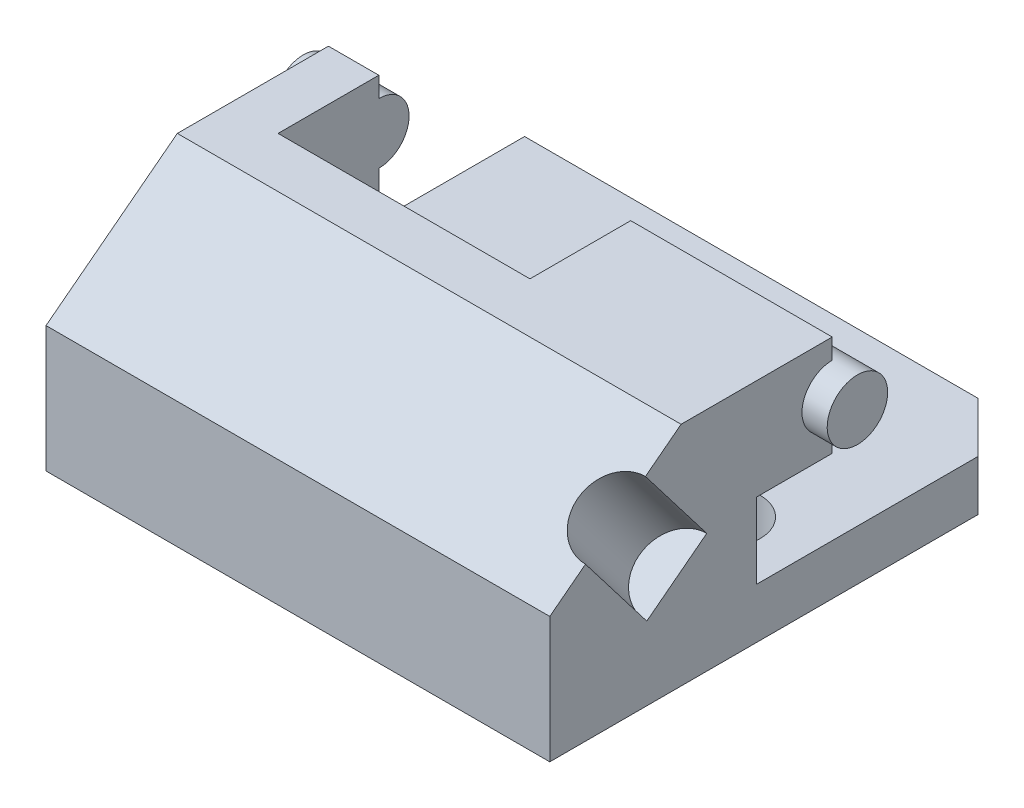
from build123d import *

# Parameters (mm, degrees)
ESQUISSE1_R             = 6
BOSS_EXTRU_1_DEPTH      = 100
ESQUISSE2_R             = 6
BOSS_EXTRU_2_DEPTH      = 5
BOSS_EXTRU_3_START      = 5
ESQUISSE3_R             = 6
BOSS_EXTRU_3_DEPTH      = 5
ENL_V_MAT_EXTRU_1_DEPTH = 20
ENL_V_MAT_EXTRU_3_REACH = 128.329
ESQUISSE5_W             = 50
ESQUISSE5_H             = 20
ESQUISSE6_W             = 50
ESQUISSE6_H             = 6
ENL_V_MAT_EXTRU_4_DEPTH = 40
ENL_V_MAT_EXTRU_5_DEPTH = 10
ENL_V_MAT_EXTRU_6_DEPTH = 10


with BuildPart() as part:
    # Esquisse1 → Boss.-Extru.1 (new body)
    with BuildSketch(Plane(origin=(0, 0, 0), x_dir=(0, 0, -1), z_dir=(1, 0, 0))):
        with BuildLine():
            Line((53.935492543, 0), (0, 0))
            Line((0, 0), (0, 15))
            Line((0, 15), (15, 15))
            Line((15, 15), (15, 19))
            ThreePointArc((15, 19), (9, 25), (15, 31))
            Line((15, 31), (15, 35))
            Line((15, 35), (-15, 35))
            Line((-15, 35), (-41.064507457, 15))
            Line((-41.064507457, 15), (-41.064507457, -10))
            Line((-41.064507457, -10), (53.935492543, -10))
            Line((53.935492543, -10), (53.935492543, 0))
        make_face()
        with Locations((15, 25)):
            Circle(ESQUISSE1_R)
    extrude(amount=BOSS_EXTRU_1_DEPTH)

    # Esquisse2 → Boss.-Extru.2 (add)
    with BuildSketch(Plane(origin=(100, 0, 0), x_dir=(0, 0, -1), z_dir=(1, 0, 0))):
        with Locations(Location((15, 25, 0), (0, 0, 90))):
            Circle(ESQUISSE2_R)
    extrude(amount=BOSS_EXTRU_2_DEPTH)

    # Esquisse3 → Boss.-Extru.3 (add)
    with BuildSketch(Plane.ZY.offset(BOSS_EXTRU_3_START)):
        with Locations((-15, 25)):
            Circle(ESQUISSE3_R)
    extrude(amount=-BOSS_EXTRU_3_DEPTH)

    # Esquisse4 → Enlèv. mat.-Extru.1 (cut)
    with BuildSketch(Plane(origin=(0, 29.273776986, 22.462559122), x_dir=(1, 0, 0), z_dir=(0, 0.7933533402912363, 0.6087614290087194))):
        with BuildLine():
            ThreePointArc((107.5, -7.020446406), (105.303300859, -1.717145547), (100, 0.479553594))
            Line((100, 0.479553594), (100, -7.020446406))
            Line((100, -7.020446406), (100, -14.520446406))
            ThreePointArc((100, -14.520446406), (105.303300859, -12.323747265), (107.5, -7.020446406))
        make_face()
        with BuildLine():
            Line((100, -7.020446406), (100, 0.479553594))
            ThreePointArc((100, 0.479553594), (92.5, -7.020446406), (100, -14.520446406))
            Line((100, -14.520446406), (100, -7.020446406))
        make_face()
    extrude(amount=-ENL_V_MAT_EXTRU_1_DEPTH, mode=Mode.SUBTRACT)

    # Enlèv. mat.-Extru.3: up to this face of the body (flat: up to its plane)
    enl_v_mat_extru_3_end = Plane(part.part.faces().sort_by_distance((50, 0, -26.967746272))[0])
    # Esquisse5 → Enlèv. mat.-Extru.3 (cut, up to the picked face)
    with BuildSketch(Plane(origin=(0, 35, 0), x_dir=(1, 0, 0), z_dir=(0, 1, 0)), mode=Mode.PRIVATE) as enl_v_mat_extru_3_sk1:
        with Locations((35, 5)):
            Rectangle(ESQUISSE5_W, ESQUISSE5_H)
    enl_v_mat_extru_3_tool1 = split(extrude(enl_v_mat_extru_3_sk1.sketch, amount=-ENL_V_MAT_EXTRU_3_REACH, mode=Mode.PRIVATE), bisect_by=enl_v_mat_extru_3_end, keep=Keep.BOTH, mode=Mode.PRIVATE)
    add(enl_v_mat_extru_3_tool1.solids().sort_by(Axis((35, 35, -5), (0, -1, 0)))[0], mode=Mode.SUBTRACT)

    # Esquisse6 → Enlèv. mat.-Extru.4 (cut)
    with BuildSketch(Plane(origin=(0, 0, 0), x_dir=(1, 0, 0), z_dir=(0, 1, 0))):
        with Locations((35, 18)):
            Rectangle(ESQUISSE6_W, ESQUISSE6_H)
    extrude(amount=ENL_V_MAT_EXTRU_4_DEPTH, mode=Mode.SUBTRACT)

    # Esquisse7 → Enlèv. mat.-Extru.5 (cut)
    with BuildSketch(Plane.XZ.offset(10)):
        with BuildLine():
            ThreePointArc((22.5, -8.148997132), (15, -0.648997132), (7.5, -8.148997132))
            Line((7.5, -8.148997132), (15, -8.148997132))
            Line((15, -8.148997132), (22.5, -8.148997132))
        make_face()
        with BuildLine():
            Line((15, -8.148997132), (7.5, -8.148997132))
            ThreePointArc((7.5, -8.148997132), (15, -15.648997132), (22.5, -8.148997132))
            Line((22.5, -8.148997132), (15, -8.148997132))
        make_face()
        with BuildLine():
            ThreePointArc((35, -0.648997132), (29.696699141, -2.845696273), (27.5, -8.148997132))
            Line((27.5, -8.148997132), (35, -8.148997132))
            Line((35, -8.148997132), (65, -8.148997132))
            Line((65, -8.148997132), (72.5, -8.148997132))
            ThreePointArc((72.5, -8.148997132), (70.303300859, -2.845696273), (65, -0.648997132))
            Line((65, -0.648997132), (35, -0.648997132))
        make_face()
        with BuildLine():
            Line((35, -8.148997132), (27.5, -8.148997132))
            ThreePointArc((27.5, -8.148997132), (29.696699141, -13.452297991), (35, -15.648997132))
            Line((35, -15.648997132), (65, -15.648997132))
            ThreePointArc((65, -15.648997132), (70.303300859, -13.452297991), (72.5, -8.148997132))
            Line((72.5, -8.148997132), (65, -8.148997132))
            Line((65, -8.148997132), (35, -8.148997132))
        make_face()
        with BuildLine():
            ThreePointArc((92.5, -8.148997132), (85, -0.648997132), (77.5, -8.148997132))
            Line((77.5, -8.148997132), (85, -8.148997132))
            Line((85, -8.148997132), (92.5, -8.148997132))
        make_face()
        with BuildLine():
            Line((85, -8.148997132), (77.5, -8.148997132))
            ThreePointArc((77.5, -8.148997132), (85, -15.648997132), (92.5, -8.148997132))
            Line((92.5, -8.148997132), (85, -8.148997132))
        make_face()
    extrude(amount=-ENL_V_MAT_EXTRU_5_DEPTH, mode=Mode.SUBTRACT)

    # Esquisse8 → Enlèv. mat.-Extru.6 (cut)
    with BuildSketch(Plane.XZ.offset(10)):
        Polygon((100, -53.935492543), (100, -43.935492543), (90, -53.935492543), align=None)
    extrude(amount=-ENL_V_MAT_EXTRU_6_DEPTH, mode=Mode.SUBTRACT)


solid = part.part
